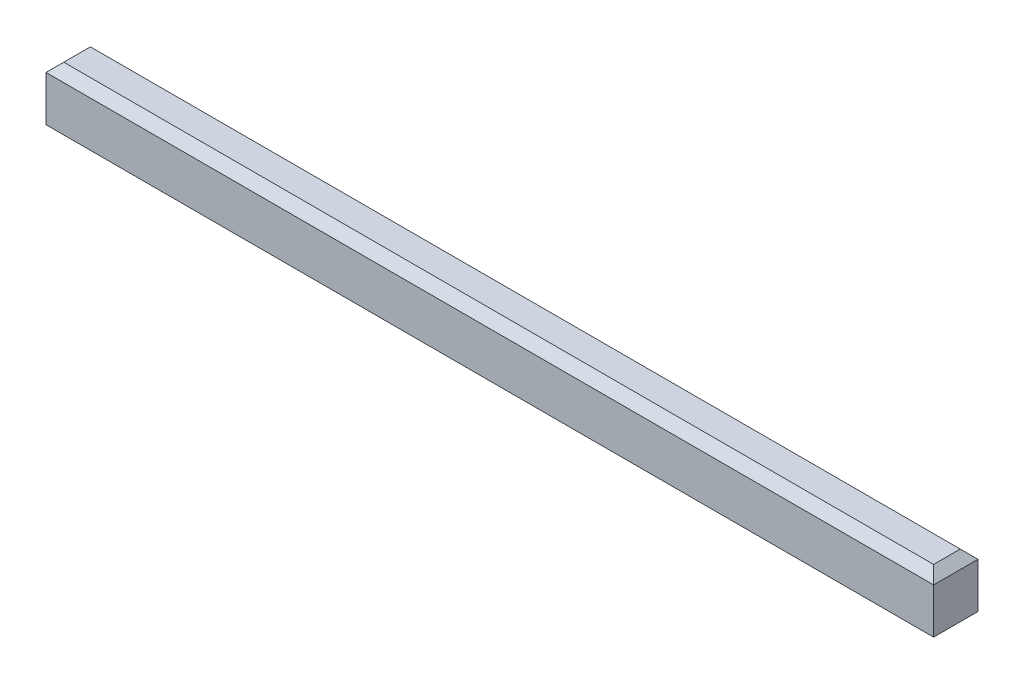
from build123d import *

# Parameters (mm, degrees)
SKETCH_1_W      = 100
SKETCH_1_H      = 6.1
EXTRUDE_1_DEPTH = 2.5
CHAMFER_1_SIZE  = 1


with BuildPart() as part:
    # 스케치1 → 보스-돌출1 (new, symmetric)
    with BuildSketch(Plane.XY):
        with Locations((50, 3.05)):
            Rectangle(SKETCH_1_W, SKETCH_1_H)
    extrude(amount=EXTRUDE_1_DEPTH, both=True)

    # 모따기1
    chamfer_1_edges = [part.edges().sort_by_distance(p)[0] for p in [
        (50, 6.1, 2.5),
        (50, 6.1, -2.5),
        (0, 6.1, 0),
        (100, 6.1, 0),
    ]]
    chamfer(chamfer_1_edges, length=CHAMFER_1_SIZE)


solid = part.part
